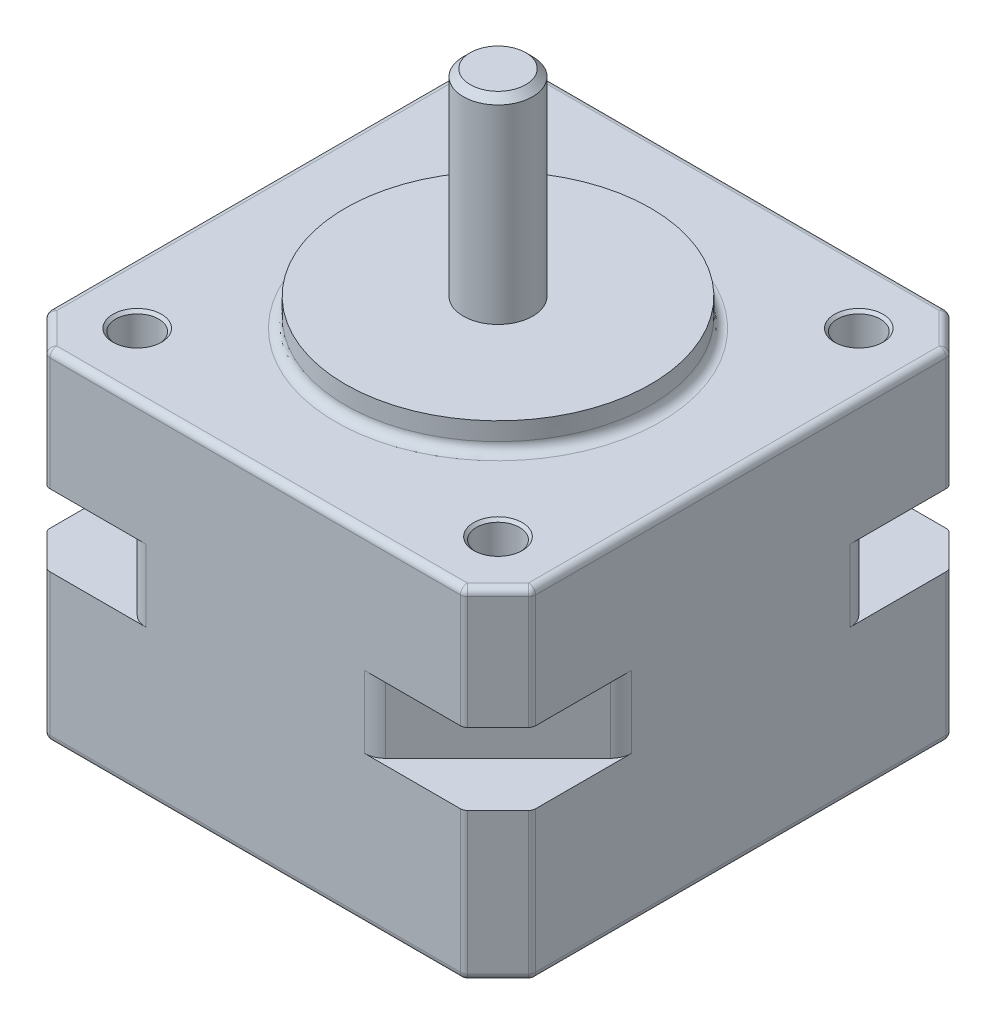
from build123d import *

# Parameters (mm, degrees)
SKETCH1_R           = 4.5
BOSS_EXTRUDE1_DEPTH = 10.7
BOSS_EXTRUDE2_DEPTH = 5.18
BOSS_EXTRUDE3_DEPTH = 8.66
SKETCH5_R           = 1.55
CUT_EXTRUDE1_DEPTH  = 7.5
SKETCH6_R           = 11
BOSS_EXTRUDE4_DEPTH = 2
SKETCH7_R           = 2.5
BOSS_EXTRUDE5_DEPTH = 14.2
CHAMFER1_SIZE       = 0.2
FILLET1_R           = 0.5
FILLET2_R           = 0.7
CHAMFER2_SIZE       = 0.5
FILLET3_R           = 1.5


with BuildPart() as part:
    # Sketch1 → Boss-Extrude1 (new body)
    with BuildSketch(Plane(origin=(0, 0, 0), x_dir=(1, 0, 0), z_dir=(0, 1, 0))):
        Polygon((-35, 32.5), (-32.5, 35), (-2.5, 35), (0, 32.5), (0, 2.5), (-2.5, 0), (-32.5, 0), (-35, 2.5), (-35, 6.85), (-36.65, 6.85), (-36.65, 28.15), (-35, 28.15), align=None)
        with Locations(Location((-17.5, 17.5, 0), (0, 0, 270))):
            Circle(SKETCH1_R, mode=Mode.SUBTRACT)
    extrude(amount=BOSS_EXTRUDE1_DEPTH)

    # Sketch2 → Boss-Extrude2 (add)
    with BuildSketch(Plane(origin=(0, 10.7, 0), x_dir=(1, 0, 0), z_dir=(0, 1, 0))):
        Polygon((-26, 35), (-9, 35), (0, 26), (0, 9), (-9, 0), (-26, 0), (-35, 9), (-35, 26), align=None)
    extrude(amount=BOSS_EXTRUDE2_DEPTH)

    # Sketch3 → Boss-Extrude3 (add)
    with BuildSketch(Plane(origin=(0, 15.88, 0), x_dir=(1, 0, 0), z_dir=(0, 1, 0))):
        Polygon((-35, 2.5), (-35, 32.5), (-32.5, 35), (-2.5, 35), (0, 32.5), (0, 2.5), (-2.5, 0), (-32.5, 0), align=None)
    extrude(amount=BOSS_EXTRUDE3_DEPTH)

    # Sketch5 → Cut-Extrude1 (cut)
    with BuildSketch(Plane(origin=(0, 24.54, 0), x_dir=(1, 0, 0), z_dir=(0, 1, 0))):
        with Locations(Location((-30.5, 4.5, 0), (0, 0, 270))):
            Circle(SKETCH5_R)
        with Locations(Location((-4.5, 30.5, 0), (0, 0, 270))):
            Circle(SKETCH5_R)
        with Locations(Location((-30.5, 30.5, 0), (0, 0, 270))):
            Circle(SKETCH5_R)
        with Locations(Location((-4.5, 4.5, 0), (0, 0, 270))):
            Circle(SKETCH5_R)
    extrude(amount=-CUT_EXTRUDE1_DEPTH, mode=Mode.SUBTRACT)

    # Sketch6 → Boss-Extrude4 (add)
    with BuildSketch(Plane(origin=(0, 24.54, 0), x_dir=(1, 0, 0), z_dir=(0, 1, 0))):
        with Locations(Location((-17.5, 17.5, 0), (0, 0, 270))):
            Circle(SKETCH6_R)
    extrude(amount=BOSS_EXTRUDE4_DEPTH)

    # Sketch7 → Boss-Extrude5 (add)
    with BuildSketch(Plane(origin=(0, 26.54, 0), x_dir=(1, 0, 0), z_dir=(0, 1, 0))):
        with Locations(Location((-17.5, 17.5, 0), (0, 0, 270))):
            Circle(SKETCH7_R)
    extrude(amount=BOSS_EXTRUDE5_DEPTH)

    # Chamfer1
    chamfer1_edges = [part.edges().sort_by_distance(p)[0] for p in [
        (-4.5, 24.54, -6.05),
        (-30.5, 24.54, -32.05),
        (-4.5, 24.54, -32.05),
        (-30.5, 24.54, -6.05),
    ]]
    chamfer(chamfer1_edges, length=CHAMFER1_SIZE)

    # Fillet1
    fillet1_edges = [part.edges().sort_by_distance(p)[0] for p in [
        (-36.65, 5.35, -28.15),
        (-36.65, 10.7, -17.5),
        (-36.65, 5.35, -6.85),
        (-17.5, 0, -22),
        (-35.825, 0, -28.15),
        (-36.65, 0, -17.5),
        (-35.825, 0, -6.85),
        (-35, 0, -4.675),
        (-33.75, 0, -1.25),
        (-17.5, 0, 0),
        (-1.25, 0, -1.25),
        (0, 0, -17.5),
        (-1.25, 0, -33.75),
        (-17.5, 0, -35),
        (-33.75, 0, -33.75),
        (-2.5, 5.35, -35),
        (0, 5.35, -32.5),
        (-32.5, 5.35, -35),
        (0, 5.35, -2.5),
        (-2.5, 5.35, 0),
        (-32.5, 5.35, 0),
        (-35, 5.35, -2.5),
        (-35, 20.21, -32.5),
        (-33.75, 24.54, -33.75),
        (-32.5, 20.21, -35),
        (-17.5, 24.54, -35),
        (-2.5, 20.21, -35),
        (0, 20.21, -32.5),
        (0, 24.54, -17.5),
        (-1.25, 24.54, -33.75),
        (0, 20.21, -2.5),
        (-2.5, 20.21, 0),
        (-35, 20.21, -2.5),
        (-32.5, 20.21, 0),
        (-1.25, 24.54, -1.25),
        (-17.5, 24.54, 0),
        (-33.75, 24.54, -1.25),
        (-35, 24.54, -17.5),
        (-35, 0, -30.325),
    ]]
    fillet(fillet1_edges, radius=FILLET1_R)

    # Fillet2
    fillet2_edges = [part.edges().sort_by_distance(p)[0] for p in [
        (-17.5, 24.54, -28.5),
    ]]
    fillet(fillet2_edges, radius=FILLET2_R)

    # Chamfer2
    chamfer2_edges = [part.edges().sort_by_distance(p)[0] for p in [
        (-17.5, 40.74, -20),
    ]]
    chamfer(chamfer2_edges, length=CHAMFER2_SIZE)

    # Fillet3
    fillet3_edges = [part.edges().sort_by_distance(p)[0] for p in [
        (-26, 13.29, -35),
        (-35, 13.29, -26),
        (-35, 13.29, -9),
        (-26, 13.29, 0),
        (-9, 13.29, 0),
        (0, 13.29, -9),
        (0, 13.29, -26),
        (-9, 13.29, -35),
    ]]
    fillet(fillet3_edges, radius=FILLET3_R)


solid = part.part
